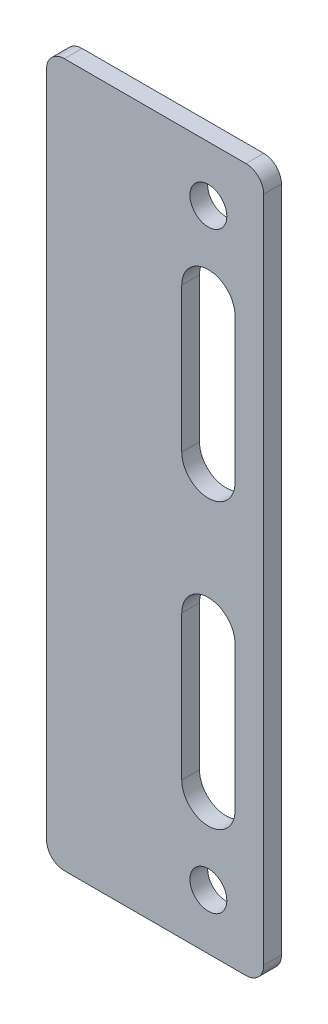
from build123d import *

# Parameters (mm, degrees)
SKETCH1_W               = 19.800000024
SKETCH1_H               = 125.800000114
SKETCH1_R               = 3.3
SKETCH1_W_2             = 19.05
BOSS_EXTRUDE1_DEPTH     = 3.175
CUT_EXTRUDE1_DEPTH      = 70.315172458
CUT_EXTRUDE1_DEPTH_BACK = 70.315172458
FILLET1_R               = 3.175


with BuildPart() as part:
    # Sketch1 → Boss-Extrude1 (new body)
    # profile 1 of 2: a face of its own
    with BuildSketch(Plane.XY):
        Rectangle(SKETCH1_W, SKETCH1_H)
        with Locations((0, -53.000000045)):
            Circle(SKETCH1_R, mode=Mode.SUBTRACT)
        with Locations((0, 53.000000045)):
            Circle(SKETCH1_R, mode=Mode.SUBTRACT)
    # profile 2 of 2: a face of its own
    with BuildSketch(Plane.XY):
        with Locations((-19.425000012, 0)):
            Rectangle(SKETCH1_W_2, SKETCH1_H)
    extrude(amount=BOSS_EXTRUDE1_DEPTH)

    # Sketch6 → Cut-Extrude1 (cut, two sides: drawn at the far end of the back side and taken through both)
    with BuildSketch(Plane.XY.offset(3.175).offset(-CUT_EXTRUDE1_DEPTH_BACK)):
        with BuildLine():
            Line((4.7625, 38.337500033), (4.7625, 12.462499967))
            ThreePointArc((4.7625, 12.462499967), (0, 7.699999967), (-4.7625, 12.462499967))
            Line((-4.7625, 12.462499967), (-4.7625, 38.337500033))
            ThreePointArc((-4.7625, 38.337500033), (0, 43.100000033), (4.7625, 38.337500033))
        make_face()
        with BuildLine():
            Line((4.7625, -12.462499967), (4.7625, -38.337500033))
            ThreePointArc((4.7625, -38.337500033), (0, -43.100000033), (-4.7625, -38.337500033))
            Line((-4.7625, -38.337500033), (-4.7625, -12.462499967))
            ThreePointArc((-4.7625, -12.462499967), (0, -7.699999967), (4.7625, -12.462499967))
        make_face()
    extrude(amount=CUT_EXTRUDE1_DEPTH + CUT_EXTRUDE1_DEPTH_BACK, mode=Mode.SUBTRACT)

    # Fillet1
    fillet1_edges = [part.edges().sort_by_distance(p)[0] for p in [
        (9.900000012, 62.900000057, 1.5875),
        (9.900000012, -62.900000057, 1.5875),
        (-28.950000012, -62.900000057, 1.5875),
        (-28.950000012, 62.900000057, 1.5875),
    ]]
    fillet(fillet1_edges, radius=FILLET1_R)


solid = part.part
